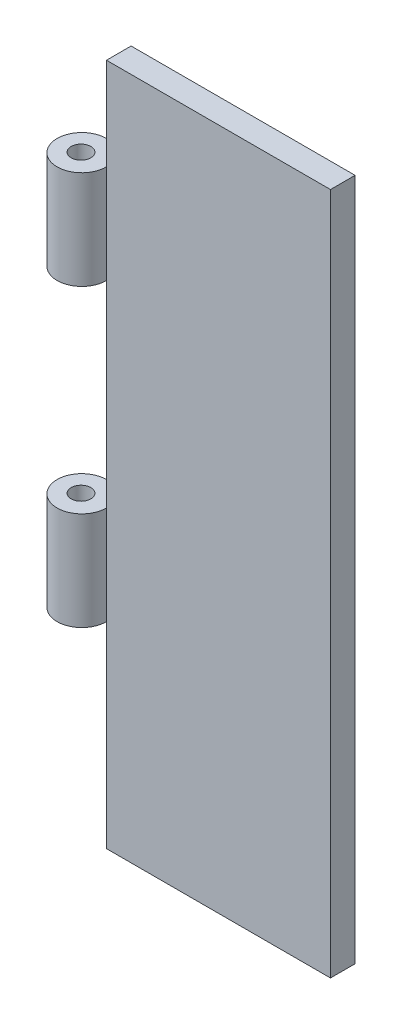
from build123d import *

# Parameters (mm, degrees)
EXTRUDE_1_DEPTH     = 5
EXTRUDE_2_DEPTH     = 20
SKETCH_4_R          = 2
CUT_EXTRUDE_1_DEPTH = 133.533705957


with BuildPart() as part:
    # 草图1 → 凸台-拉伸1 (new body)
    with BuildSketch(Plane.XY):
        Polygon((0, 0), (0, 68.759266336), (-45.494055631, 68.759266336), (-45.494055631, -69.930579597), (0, -69.930579597), align=None)
    extrude(amount=EXTRUDE_1_DEPTH)

    # 草图2 → 凸台-拉伸2 (add)
    with BuildSketch(Plane(origin=(0, 30, 0), x_dir=(1, 0, 0), z_dir=(0, 1, 0))):
        with BuildLine():
            Line((-45.494055631, 0), (-50.502634201, 0))
            ThreePointArc((-50.502634201, 0), (-54.041202389, -8.553225288), (-45.494055631, -5))
            Line((-45.494055631, -5), (-45.494055631, 0))
        make_face()
    extrude_2 = extrude(amount=EXTRUDE_2_DEPTH)

    # 镜向2: 凸台-拉伸2 across plane
    add(extrude_2.mirror(Plane.ZX.offset(10)))

    # 草图4 → 切除-拉伸1 (cut, through all)
    with BuildSketch(Plane(origin=(0, 50, 0), x_dir=(1, 0, 0), z_dir=(0, 1, 0))):
        with Locations(Location((-50.678910059, -4.995787087, 0), (0, 0, 90))):
            Circle(SKETCH_4_R)
    extrude(amount=-CUT_EXTRUDE_1_DEPTH, mode=Mode.SUBTRACT)


solid = part.part
